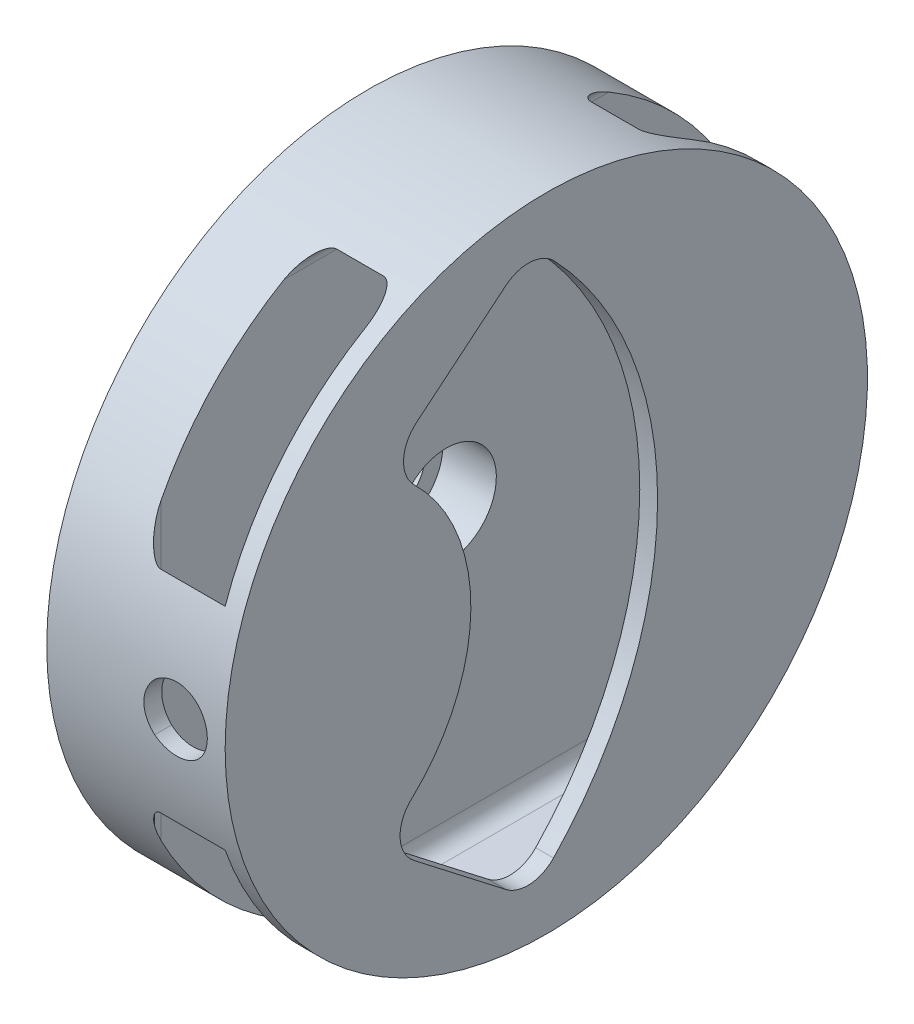
from build123d import *

# Parameters (mm, degrees)
CORTAR_EXTRUIR1_DEPTH      = 1
CORTAR_EXTRUIR3_DEPTH      = 35
CORTAR_EXTRUIR4_DEPTH      = 24
CORTAR_EXTRUIR5_REACH      = 34.373
CROQUIS6_R                 = 1.8
CORTAR_EXTRUIR6_DEPTH      = 30.24653838
CORTAR_EXTRUIR6_DEPTH_BACK = 3
CROQUIS7_R                 = 2.8
REDONDEO1_R                = 2
REDONDEO2_R                = 1
REDONDEO3_R                = 1


with BuildPart() as part:
    # Croquis1 → Revolución1 (revolve)
    with BuildSketch(Plane.XY, mode=Mode.PRIVATE) as revoluci_n1_sk:
        Polygon((0, 0), (0, 3), (10, 3), (10, 18), (20, 18), (20, 0), align=None)
    revolve(revoluci_n1_sk.sketch.rotate(Axis((-25.36492891, 0, 0), (1, 0, 0)), 90), axis=Axis((-25.36492891, 0, 0), (1, 0, 0)))

    # Croquis2 → Cortar-Extruir1 (cut)
    with BuildSketch(Plane(origin=(20, 0, 0), x_dir=(0, 0, -1), z_dir=(1, 0, 0))):
        with BuildLine():
            Line((-9.183440496, 8.902465622), (-0.902762127, 15.75))
            ThreePointArc((-0.902762127, 15.75), (6.237962948, 0), (-0.902762127, -15.75))
            Line((-0.902762127, -15.75), (-9.50624249, -9.09463967))
            ThreePointArc((-9.50624249, -9.09463967), (-4.229487685, -0.187837691), (-9.183440496, 8.902465622))
        make_face()
    extrude(amount=-CORTAR_EXTRUIR1_DEPTH, mode=Mode.SUBTRACT)

    # Croquis4 → Cortar-Extruir3 (cut)
    with BuildSketch(Plane(origin=(0, 0, -18), x_dir=(-1, 0, 0), z_dir=(0, 0, -1))):
        Polygon((-19, 15.75), (-19, 8.902465622), (-19, -9.09463967), (-19, -15.75), (-19, -16.274754547), (-14.4, -16.274754547), (-14.4, 16.524155196), (-19, 16.524155196), align=None)
    extrude(amount=-CORTAR_EXTRUIR3_DEPTH, mode=Mode.SUBTRACT)

    # Croquis5 → Cortar-Extruir4 (cut)
    with BuildSketch(Plane.XY.offset(18)):
        with BuildLine():
            ThreePointArc((16, -1.341640786), (19, 0), (16, 1.341640786))
            ThreePointArc((16, 1.341640786), (15.44427419, 0), (16, -1.341640786))
        make_face()
    extrude(amount=-CORTAR_EXTRUIR4_DEPTH, mode=Mode.SUBTRACT)

    # Croquis6 → Cortar-Extruir5 (cut, up to next)
    with BuildSketch(Plane.ZY, mode=Mode.PRIVATE) as cortar_extruir5_sk1:
        Circle(CROQUIS6_R)
    cortar_extruir5_tool1 = extrude(cortar_extruir5_sk1.sketch, amount=-CORTAR_EXTRUIR5_REACH, mode=Mode.PRIVATE) & part.part
    add(cortar_extruir5_tool1.solids().sort_by_distance((0, 0, 0))[0], mode=Mode.SUBTRACT)

    # Croquis7 → Cortar-Extruir6 (cut, two sides: drawn at the far end of the back side and taken through both)
    with BuildSketch(Plane(origin=(14.4, 0, 0), x_dir=(0, 0, -1), z_dir=(1, 0, 0)).offset(-CORTAR_EXTRUIR6_DEPTH_BACK)):
        with Locations(Location((0, 0, 0), (0, 0, 270))):
            Circle(CROQUIS7_R)
    extrude(amount=CORTAR_EXTRUIR6_DEPTH + CORTAR_EXTRUIR6_DEPTH_BACK, mode=Mode.SUBTRACT)

    # Redondeo1
    redondeo1_edges = [part.edges().sort_by_distance(p)[0] for p in [
        (19.5, 15.75, 0.902762127),
        (19.5, -15.75, 0.902762127),
        (19.5, -9.09463967, 9.50624249),
        (19.5, 8.902465622, 9.183440496),
    ]]
    fillet(redondeo1_edges, radius=REDONDEO1_R)

    # Redondeo2
    redondeo2_edges = [part.edges().sort_by_distance(p)[0] for p in [
        (19, 16.524155196, 0),
        (14.4, 16.524155196, 0),
        (14.4, -16.274754547, 0),
        (19, -16.274754547, 0),
    ]]
    fillet(redondeo2_edges, radius=REDONDEO2_R)

    # Redondeo3
    redondeo3_edges = [part.edges().sort_by_distance(p)[0] for p in [
        (14.4, 0, 17),
    ]]
    fillet(redondeo3_edges, radius=REDONDEO3_R)


solid = part.part
